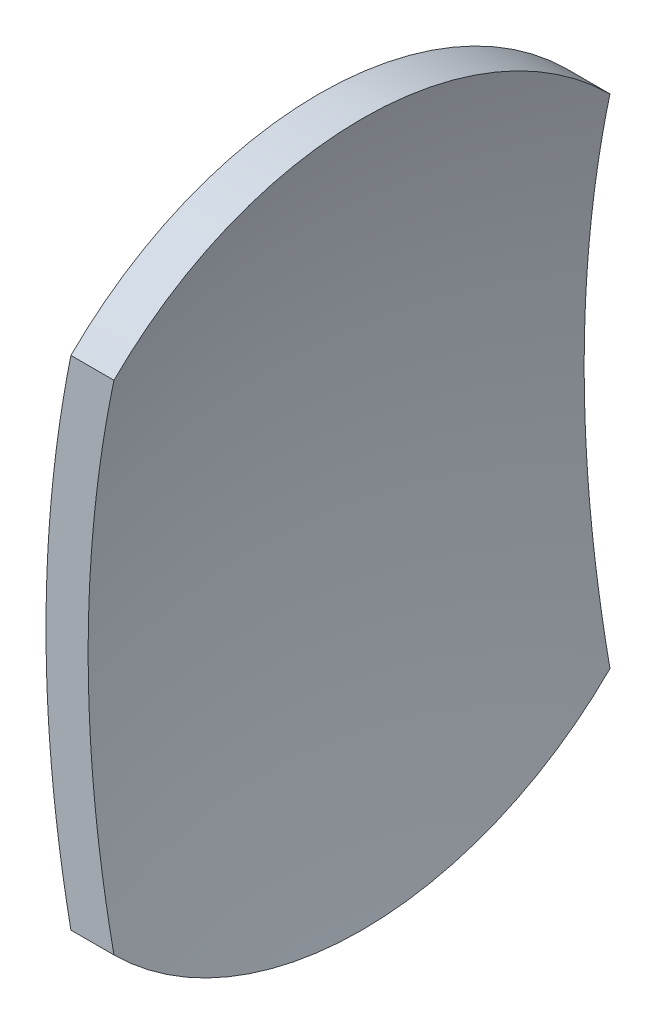
from build123d import *

# Parameters (mm, degrees)
CUT_EXTRUDE_1_REACH      = 68.498
CUT_EXTRUDE_1_END_RADIUS = 62


with BuildPart() as part:
    # 草图2 → 旋转1 (revolve)
    with BuildSketch(Plane.XY):
        with BuildLine():
            Line((-59.623820743, 17), (-57.541289523, 17))
            ThreePointArc((-57.541289523, 17), (-59.382141134, 8.588440738), (-60, 0))
            Line((-60, 0), (-62, 0))
            ThreePointArc((-62, 0), (-61.403081706, 8.582631121), (-59.623820743, 17))
        make_face()
    revolve(axis=Axis((0, 0, 0), (-1, 0, 0)))

    # 切除-拉伸1: up to this sphere (the profile starts inside it)
    cut_extrude_1_end = Location((0, 0, 0)) * Sphere(CUT_EXTRUDE_1_END_RADIUS, mode=Mode.PRIVATE)
    # 草图3 → 切除-拉伸1 (cut, up to the surface)
    with BuildSketch(Plane(origin=(0, 0, 0), x_dir=(0, 0, -1), z_dir=(1, 0, 0)), mode=Mode.PRIVATE) as cut_extrude_1_sk1:
        with BuildLine():
            Line((-12, 12.041594579), (-12, -12.041594579))
            ThreePointArc((-12, -12.041594579), (-17, 0), (-12, 12.041594579))
        make_face()
    cut_extrude_1_tool1 = extrude(cut_extrude_1_sk1.sketch, amount=-CUT_EXTRUDE_1_REACH, mode=Mode.PRIVATE) & cut_extrude_1_end
    add(cut_extrude_1_tool1.solids().sort_by_distance((0, 0, 14.027569))[0], mode=Mode.SUBTRACT)
    # 草图3 → 切除-拉伸1 (cut, up to the surface)
    with BuildSketch(Plane(origin=(0, 0, 0), x_dir=(0, 0, -1), z_dir=(1, 0, 0)), mode=Mode.PRIVATE) as cut_extrude_1_sk2:
        with BuildLine():
            Line((12, 12.041594579), (12, -12.041594579))
            ThreePointArc((12, -12.041594579), (17, 0), (12, 12.041594579))
        make_face()
    cut_extrude_1_tool2 = extrude(cut_extrude_1_sk2.sketch, amount=-CUT_EXTRUDE_1_REACH, mode=Mode.PRIVATE) & cut_extrude_1_end
    add(cut_extrude_1_tool2.solids().sort_by_distance((0, 0, -14.027569))[0], mode=Mode.SUBTRACT)


solid = part.part
